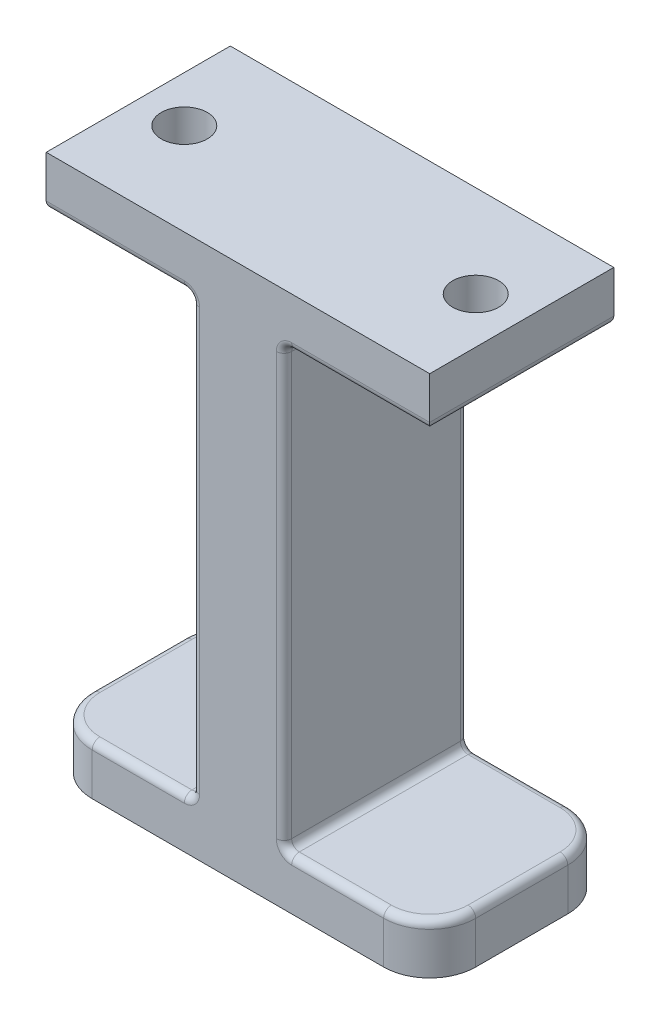
from build123d import *

# Parameters (mm, degrees)
BOSS_EXTRUDE1_DEPTH = 6
FILLET1_R           = 3
CUT_EXTRUDE1_REACH  = 39.646
SKETCH2_R           = 1.5
FILLET2_R           = 0.5


with BuildPart() as part:
    # Sketch1 → Boss-Extrude1 (new, symmetric)
    with BuildSketch(Plane.XY):
        Polygon((0, 0), (-12.5, 0), (-12.5, 3.25), (-3, 3.25), (-3, 31.75), (-12.5, 31.75), (-12.5, 35), (12.5, 35), (12.5, 31.75), (3, 31.75), (3, 3.25), (12.5, 3.25), (12.5, 0), align=None)
    extrude(amount=BOSS_EXTRUDE1_DEPTH, both=True)

    # Fillet1
    fillet1_edges = [part.edges().sort_by_distance(p)[0] for p in [
        (-12.5, 1.625, -6),
        (12.5, 1.625, -6),
        (-12.5, 1.625, 6),
        (12.5, 1.625, 6),
    ]]
    fillet(fillet1_edges, radius=FILLET1_R)

    # Sketch2 → Cut-Extrude1 (cut, up to next)
    with BuildSketch(Plane(origin=(0, 35, 0), x_dir=(1, 0, 0), z_dir=(0, 1, 0)), mode=Mode.PRIVATE) as cut_extrude1_sk1:
        with Locations(Location((-9.5, 0, 0), (0, 0, 270))):
            Circle(SKETCH2_R)
    cut_extrude1_tool1 = extrude(cut_extrude1_sk1.sketch, amount=-CUT_EXTRUDE1_REACH, mode=Mode.PRIVATE) & part.part
    # Sketch2 → Cut-Extrude1 (cut, up to next)
    with BuildSketch(Plane(origin=(0, 35, 0), x_dir=(1, 0, 0), z_dir=(0, 1, 0)), mode=Mode.PRIVATE) as cut_extrude1_sk2:
        with Locations(Location((9.5, 0, 0), (0, 0, 270))):
            Circle(SKETCH2_R)
    cut_extrude1_tool2 = extrude(cut_extrude1_sk2.sketch, amount=-CUT_EXTRUDE1_REACH, mode=Mode.PRIVATE) & part.part
    add(cut_extrude1_tool1.solids().sort_by_distance((-9.5, 35, 0))[0], mode=Mode.SUBTRACT)
    add(cut_extrude1_tool2.solids().sort_by_distance((9.5, 35, 0))[0], mode=Mode.SUBTRACT)

    # Fillet2
    fillet2_edges = [part.edges().sort_by_distance(p)[0] for p in [
        (-6.25, 3.25, -6),
        (-3, 17.5, -6),
        (-7.75, 31.75, -6),
        (7.75, 31.75, -6),
        (3, 17.5, -6),
        (3, 17.5, 6),
        (7.75, 31.75, 6),
        (-3, 3.25, 0),
        (-3, 31.75, 0),
        (-12.5, 31.75, 0),
        (12.5, 31.75, 0),
        (3, 31.75, 0),
        (3, 3.25, 0),
        (-7.75, 31.75, 6),
        (-12.5, 3.25, 0),
        (-3, 17.5, 6),
        (-6.25, 3.25, 6),
        (6.25, 3.25, -6),
        (-11.621320344, 3.25, 5.121320344),
        (-11.621320344, 3.25, -5.121320344),
        (12.5, 3.25, 0),
        (6.25, 3.25, 6),
        (11.621320344, 3.25, 5.121320344),
        (11.621320344, 3.25, -5.121320344),
    ]]
    fillet(fillet2_edges, radius=FILLET2_R)


solid = part.part
